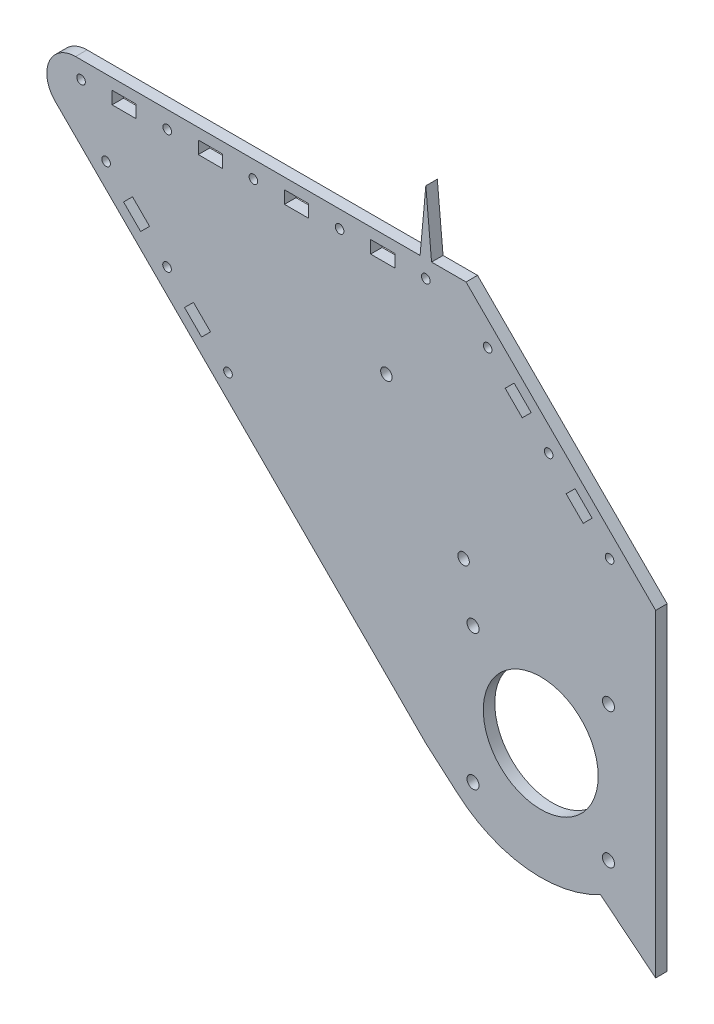
from build123d import *

# Parameters (mm, degrees)
SKETCH_1_R      = 1.5
SKETCH_1_R_2    = 20
SKETCH_1_R_3    = 2.1
SKETCH_1_R_4    = 2
SKETCH_1_W      = 8.4
SKETCH_1_H      = 4.4
EXTRUDE_1_DEPTH = 4
EXTRUDE_2_DEPTH = 4
EXTRUDE_4_DEPTH = 4


with BuildPart() as part:
    # 草图1 → 凸台-拉伸1 (new body)
    with BuildSketch(Plane.XY):
        with BuildLine():
            Line((7.027428163, -5.002489357), (18.190287148, -14.686974418))
            ThreePointArc((18.190287148, -14.686974418), (47.018030055, -25.451404949), (75.84881126, -14.695114654))
            Line((75.84881126, -14.695114654), (87.027428163, -5.002489357))
            Line((87.027428163, -5.002489357), (87.027428163, 75.054738201))
            Line((87.027428163, 75.054738201), (21.027428163, 141.054738201))
            Line((21.027428163, 141.054738201), (-114.887663771, 141.054738201))
            ThreePointArc((-114.887663771, 141.054738201), (-124.126459096, 134.881572525), (-121.958731583, 123.983670389))
            Line((-121.958731583, 123.983670389), (-90.203942848, 92.228881654))
            Line((-90.203942848, 92.228881654), (7.027428163, -5.002489357))
        make_face()
        with Locations((-52.972571837, 135.054738201)):
            Circle(SKETCH_1_R, mode=Mode.SUBTRACT)
        with Locations((47.027428163, 15.054738201)):
            Circle(SKETCH_1_R_2, mode=Mode.SUBTRACT)
        with Locations(Location((-22.972571837, 135.054738201, 0), (0, 0, 180))):
            Circle(SKETCH_1_R, mode=Mode.SUBTRACT)
        with Locations((7.027428163, 135.054738201)):
            Circle(SKETCH_1_R, mode=Mode.SUBTRACT)
        with Locations(Location((-112.972571837, 135.054738201, 0), (0, 0, 180))):
            Circle(SKETCH_1_R, mode=Mode.SUBTRACT)
        with Locations((-82.972571837, 135.054738201)):
            Circle(SKETCH_1_R, mode=Mode.SUBTRACT)
        with Locations((49.784787476, 103.812097514)):
            Circle(SKETCH_1_R, mode=Mode.SUBTRACT)
        with Locations(Location((70.997990912, 82.598894078, 0), (0, 0, 180))):
            Circle(SKETCH_1_R, mode=Mode.SUBTRACT)
        with Locations(Location((28.571584041, 125.025300949, 0), (0, 0, 180))):
            Circle(SKETCH_1_R, mode=Mode.SUBTRACT)
        with Locations((70.597428163, 38.624738201)):
            Circle(SKETCH_1_R_3, mode=Mode.SUBTRACT)
        with Locations((70.597428163, -8.515261799)):
            Circle(SKETCH_1_R_3, mode=Mode.SUBTRACT)
        with Locations((23.457428163, -8.515261799)):
            Circle(SKETCH_1_R_3, mode=Mode.SUBTRACT)
        with Locations((23.457428163, 38.624738201)):
            Circle(SKETCH_1_R_3, mode=Mode.SUBTRACT)
        with Locations((-83.04451802, 93.554738201)):
            Circle(SKETCH_1_R, mode=Mode.SUBTRACT)
        with Locations((-61.831314585, 72.341534765)):
            Circle(SKETCH_1_R, mode=Mode.SUBTRACT)
        with Locations(Location((-104.257721456, 114.767941637, 0), (0, 0, 180))):
            Circle(SKETCH_1_R, mode=Mode.SUBTRACT)
        with Locations((20.166275086, 57.226748532)):
            Circle(SKETCH_1_R_4, mode=Mode.SUBTRACT)
        with Locations((-6.694877991, 99.398758863)):
            Circle(SKETCH_1_R_4, mode=Mode.SUBTRACT)
        with Locations((-37.972571837, 135.054738201)):
            Rectangle(SKETCH_1_W, SKETCH_1_H, mode=Mode.SUBTRACT)
        with Locations((-7.972571837, 135.054738201)):
            Rectangle(SKETCH_1_W, SKETCH_1_H, mode=Mode.SUBTRACT)
        with Locations((-97.972571837, 135.054738201)):
            Rectangle(SKETCH_1_W, SKETCH_1_H, mode=Mode.SUBTRACT)
        with Locations((-67.972571837, 135.054738201)):
            Rectangle(SKETCH_1_W, SKETCH_1_H, mode=Mode.SUBTRACT)
        Polygon((55.865905794, 94.619709358), (61.805602756, 88.680012396), (64.916872594, 91.791282234), (58.977175632, 97.730979196), align=None, mode=Mode.SUBTRACT)
        Polygon((34.652702359, 115.832912794), (37.763972196, 118.944182631), (43.703669158, 113.004485669), (40.592399321, 109.893215832), align=None, mode=Mode.SUBTRACT)
        Polygon((-73.852129865, 87.473619883), (-76.963399702, 84.362350046), (-71.02370274, 78.422653084), (-67.912432903, 81.533922921), align=None, mode=Mode.SUBTRACT)
        Polygon((-89.125636339, 102.747126356), (-92.236906176, 99.635856519), (-98.176603138, 105.575553481), (-95.065333301, 108.686823318), align=None, mode=Mode.SUBTRACT)
    extrude(amount=EXTRUDE_1_DEPTH)

    # 草图2 → 凸台-拉伸2 (add)
    with BuildSketch(Plane.XY.offset(4)):
        Polygon((87.027428163, -5.002489357), (87.027428163, -35.754116483), (67.811833288, -20.231246124), align=None)
    extrude(amount=-EXTRUDE_2_DEPTH)

    # 草图3 → 凸台-拉伸4 (add)
    with BuildSketch(Plane.XY.offset(4)):
        Polygon((7.027428163, 141.054738201), (5.027428163, 141.054738201), (7.027428163, 163.054738201), (9.027428163, 141.054738201), align=None)
    extrude(amount=-EXTRUDE_4_DEPTH)


solid = part.part
